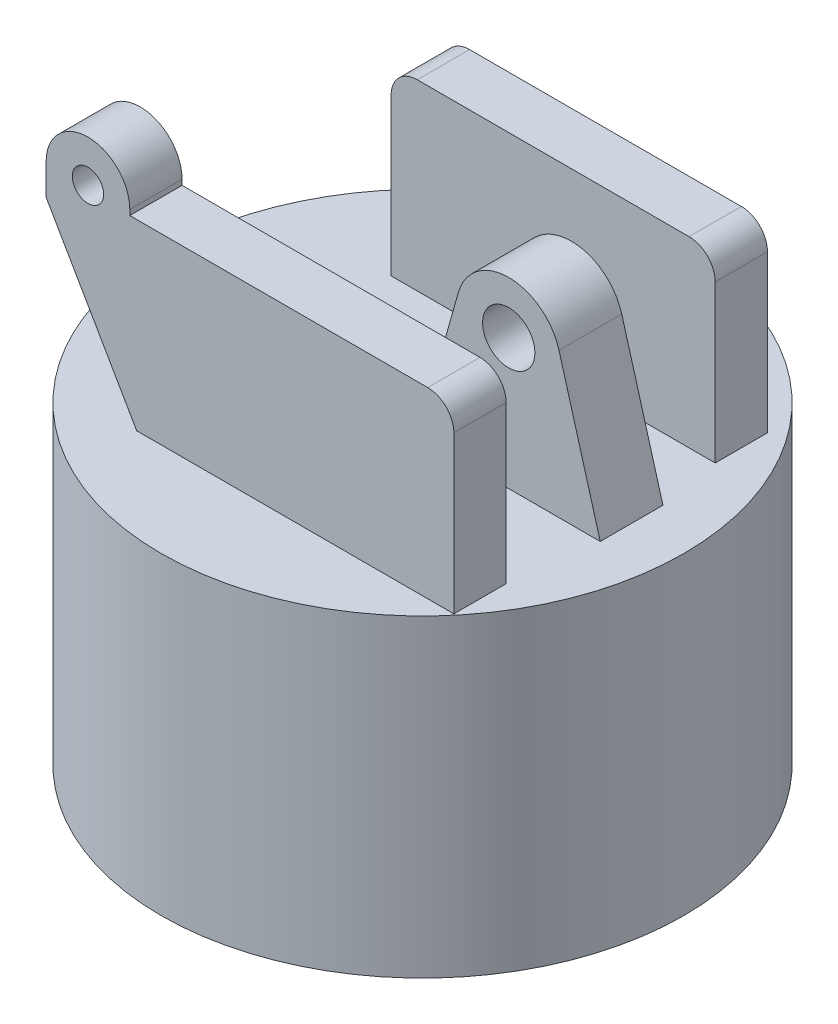
from build123d import *

# Parameters (mm, degrees)
SKETCH_1_R      = 50
EXTRUDE_1_DEPTH = 60
EXTRUDE_START   = 22
SKETCH_2_R      = 3
EXTRUDE_2_DEPTH = 10
EXTRUDE_START_2 = -18
SKETCH_3_W      = 62
SKETCH_3_H      = 35
EXTRUDE_3_DEPTH = 10
FILLET_1_R      = 5
SKETCH_4_R      = 5
EXTRUDE_4_DEPTH = 6


with BuildPart() as part:
    # 草图1 → 凸台-拉伸1 (new body)
    with BuildSketch(Plane(origin=(0, 0, 0), x_dir=(1, 0, 0), z_dir=(0, 1, 0))):
        with Locations(Location((0, 0, 0), (0, 0, 90))):
            Circle(SKETCH_1_R)
    extrude(amount=EXTRUDE_1_DEPTH)

    # 草图2 → 凸台-拉伸2 (add)
    with BuildSketch(Plane.XY.offset(EXTRUDE_START)):
        with BuildLine():
            Line((38, 60), (38, 95))
            Line((38, 95), (-24, 95))
            Line((-24, 95), (-24, 96))
            ThreePointArc((-24, 96), (-32, 104), (-40, 96))
            Line((-40, 96), (-40, 90))
            Line((-40, 90), (-22.679491924, 60))
            Line((-22.679491924, 60), (38, 60))
        make_face()
        with Locations((-32, 96)):
            Circle(SKETCH_2_R, mode=Mode.SUBTRACT)
    extrude(amount=EXTRUDE_2_DEPTH)

    # 草图3 → 凸台-拉伸3 (add)
    with BuildSketch(Plane.XY.offset(EXTRUDE_START_2)):
        with Locations((7, 77.5)):
            Rectangle(SKETCH_3_W, SKETCH_3_H)
    extrude(amount=-EXTRUDE_3_DEPTH)

    # 圆角1
    fillet_1_edges = [part.edges().sort_by_distance(p)[0] for p in [
        (38, 95, 27),
        (38, 95, -23),
        (-24, 95, -23),
    ]]
    fillet(fillet_1_edges, radius=FILLET_1_R)

    # 草图4 → 凸台-拉伸4 (add, symmetric)
    with BuildSketch(Plane.XY):
        with BuildLine():
            Line((12.880830473, 87.733418669), (5, 60))
            Line((5, 60), (40, 60))
            Line((40, 60), (32.119169527, 87.733418669))
            ThreePointArc((32.119169527, 87.733418669), (22.5, 95), (12.880830473, 87.733418669))
        make_face()
        with Locations((22.5, 85)):
            Circle(SKETCH_4_R, mode=Mode.SUBTRACT)
    extrude(amount=EXTRUDE_4_DEPTH, both=True)


solid = part.part
